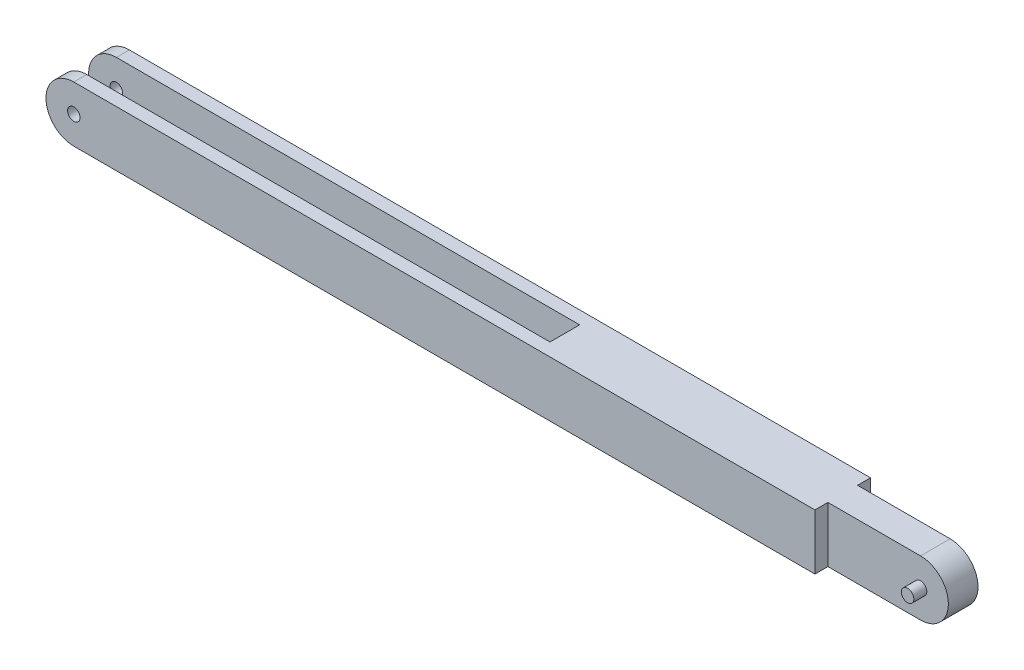
from build123d import *

# Parameters (mm, degrees)
BOSS_EXTRUDE1_DEPTH             = 15
H_0_266_DIAMETER_HOLE1_D        = 6.7564
SKETCH5_W                       = 1000
SKETCH5_H                       = 16
SKETCH5_W_2                     = 70
SKETCH5_H_2                     = 20.916111238
CUT_EXTRUDE1_DEPTH              = 243.332416321
BOSS_EXTRUDE4_REACH             = 242.936
SKETCH6_R                       = 3.3782
BOSS_EXTRUDE4_DIRECTION_2_REACH = 242.936


with BuildPart() as part:
    # Sketch1 → Boss-Extrude1 (new, symmetric)
    with BuildSketch(Plane.XY):
        with BuildLine():
            Line((-225, 15), (225, 15))
            ThreePointArc((225, 15), (240, 0), (225, -15))
            Line((225, -15), (-225, -15))
            ThreePointArc((-225, -15), (-240, 0), (-225, 15))
        make_face()
    extrude(amount=BOSS_EXTRUDE1_DEPTH, both=True)

    # H (0.266) Diameter Hole1 (through all)
    with Locations(Plane.XY.offset(15)):
        with Locations((-225, 0), (225, 0)):
            Hole(H_0_266_DIAMETER_HOLE1_D / 2)

    # Sketch5 → Cut-Extrude1 (cut, through all)
    with BuildSketch(Plane(origin=(0, 15, 0), x_dir=(1, 0, 0), z_dir=(0, 1, 0))):
        with Locations((-475, 0)):
            Rectangle(SKETCH5_W, SKETCH5_H)
        with Locations((210, 18.458055619)):
            Rectangle(SKETCH5_W_2, SKETCH5_H_2)
        with Locations((210, -18.458055619)):
            Rectangle(SKETCH5_W_2, SKETCH5_H_2)
    extrude(amount=-CUT_EXTRUDE1_DEPTH, mode=Mode.SUBTRACT)

    # Boss-Extrude4: up to this face of the body (flat: up to its plane)
    boss_extrude4_end = Plane(part.part.faces().sort_by_distance((-30.33914406, 0, 15))[0])
    # Sketch6 → Boss-Extrude4 (add, up to the picked face)
    with BuildSketch(Plane.XY, mode=Mode.PRIVATE) as boss_extrude4_sk1:
        with Locations((225, 0)):
            Circle(SKETCH6_R)
    boss_extrude4_tool1 = split(extrude(boss_extrude4_sk1.sketch, amount=BOSS_EXTRUDE4_REACH, mode=Mode.PRIVATE), bisect_by=boss_extrude4_end, keep=Keep.BOTH, mode=Mode.PRIVATE)
    add(boss_extrude4_tool1.solids().sort_by(Axis((225, 0, 0), (0, 0, 1)))[0])

    # Boss-Extrude4 direction 2: up to this face of the body (flat: up to its plane)
    boss_extrude4_direction_2_end = Plane(part.part.faces().sort_by_distance((-30.33914406, 0, -15))[0])
    # Sketch6 → Boss-Extrude4 direction 2 (add, up to the picked face)
    with BuildSketch(Plane.XY, mode=Mode.PRIVATE) as boss_extrude4_direction_2_sk1:
        with Locations((225, 0)):
            Circle(SKETCH6_R)
    boss_extrude4_direction_2_tool1 = split(extrude(boss_extrude4_direction_2_sk1.sketch, amount=-BOSS_EXTRUDE4_DIRECTION_2_REACH, mode=Mode.PRIVATE), bisect_by=boss_extrude4_direction_2_end, keep=Keep.BOTH, mode=Mode.PRIVATE)
    add(boss_extrude4_direction_2_tool1.solids().sort_by(Axis((225, 0, 0), (0, 0, -1)))[0])


solid = part.part
